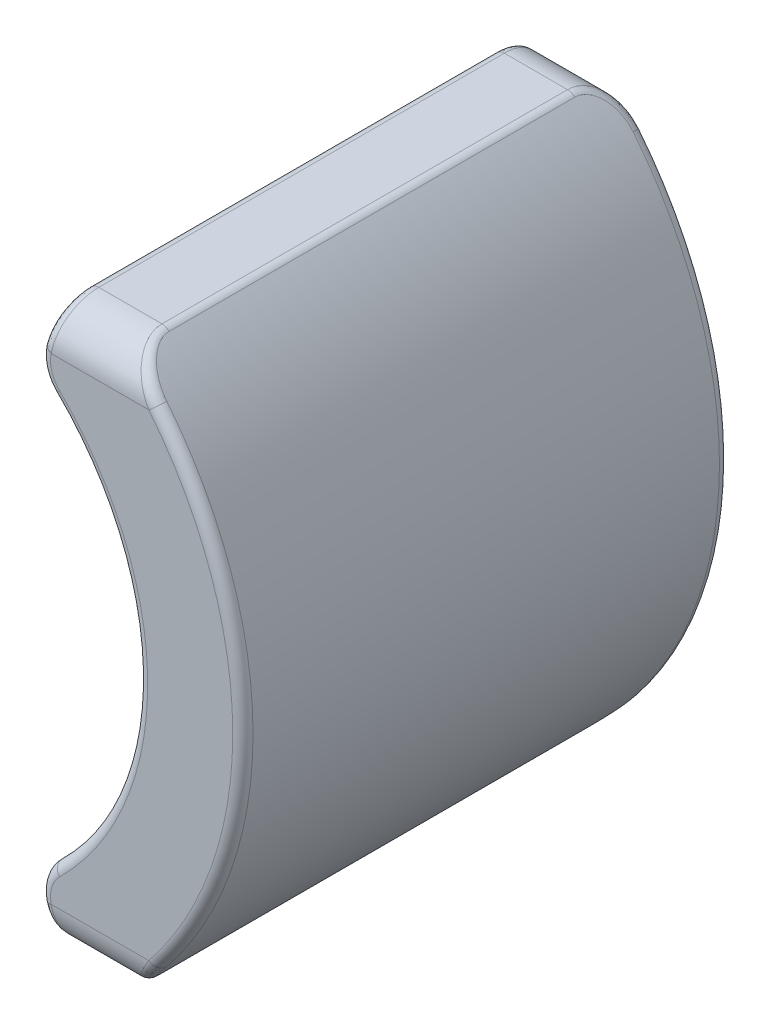
from build123d import *

# Parameters (mm, degrees)
BOSS_EXTRUDE1_DEPTH = 12
FILLET1_R           = 1
FILLET2_R           = 1
FILLET3_R           = 0.25


with BuildPart() as part:
    # Sketch1 → Boss-Extrude1 (new body)
    with BuildSketch(Plane.XY):
        with BuildLine():
            Line((6.738137725, -6.88), (4.878137725, -6.88))
            Line((4.878137725, -6.88), (4.531835438, -5.38))
            ThreePointArc((4.531835438, -5.38), (7.034339517, 0), (4.531835438, 5.38))
            Line((4.531835438, 5.38), (4.878137725, 6.88))
            Line((4.878137725, 6.88), (6.738137725, 6.88))
            ThreePointArc((6.738137725, 6.88), (9.63, 0), (6.738137725, -6.88))
        make_face()
    extrude(amount=BOSS_EXTRUDE1_DEPTH)

    # Fillet1
    fillet1_edges = [part.edges().sort_by_distance(p)[0] for p in [
        (4.531835438, -5.38, 6),
        (4.531835438, 5.38, 6),
    ]]
    fillet(fillet1_edges, radius=FILLET1_R)

    # Fillet2
    fillet2_edges = [part.edges().sort_by_distance(p)[0] for p in [
        (5.808137725, -6.88, 0),
        (5.808137725, -6.88, 12),
        (5.808137725, 6.88, 12),
        (5.808137725, 6.88, 0),
    ]]
    fillet(fillet2_edges, radius=FILLET2_R)

    # Fillet3
    fillet3_edges = [part.edges().sort_by_distance(p)[0] for p in [
        (7.034339517, 0, 0),
        (4.687877266, 5.411310183, 0),
        (7.034339517, 0, 12),
        (4.687877266, -5.411310183, 12),
        (6.738137725, -6.88, 6),
        (4.878137725, -6.88, 6),
        (9.63, 0, 0),
        (6.738137725, 6.88, 6),
        (9.63, 0, 12),
        (7.064336577, 6.544619807, 0.2528183),
        (7.064336577, 6.544619807, 11.7471817),
        (7.064336589, -6.544619821, 11.747181705),
        (7.064336577, -6.544619807, 0.2528183),
        (4.687877266, -5.411310183, 0),
        (4.655934772, -5.914769545, 11.999395357),
        (4.655934772, -5.914769545, 0.000604643),
        (4.815123489, -6.607055355, 11.686578845),
        (4.815123489, -6.607055355, 0.313421155),
        (4.687877266, 5.411310183, 12),
        (4.655934776, 5.914769544, 0.00060465),
        (4.655934776, 5.914769544, 11.99939535),
        (4.878137725, 6.88, 6),
        (4.815123489, 6.607055355, 0.313421155),
        (4.815123489, 6.607055355, 11.686578845),
    ]]
    fillet(fillet3_edges, radius=FILLET3_R)


solid = part.part
